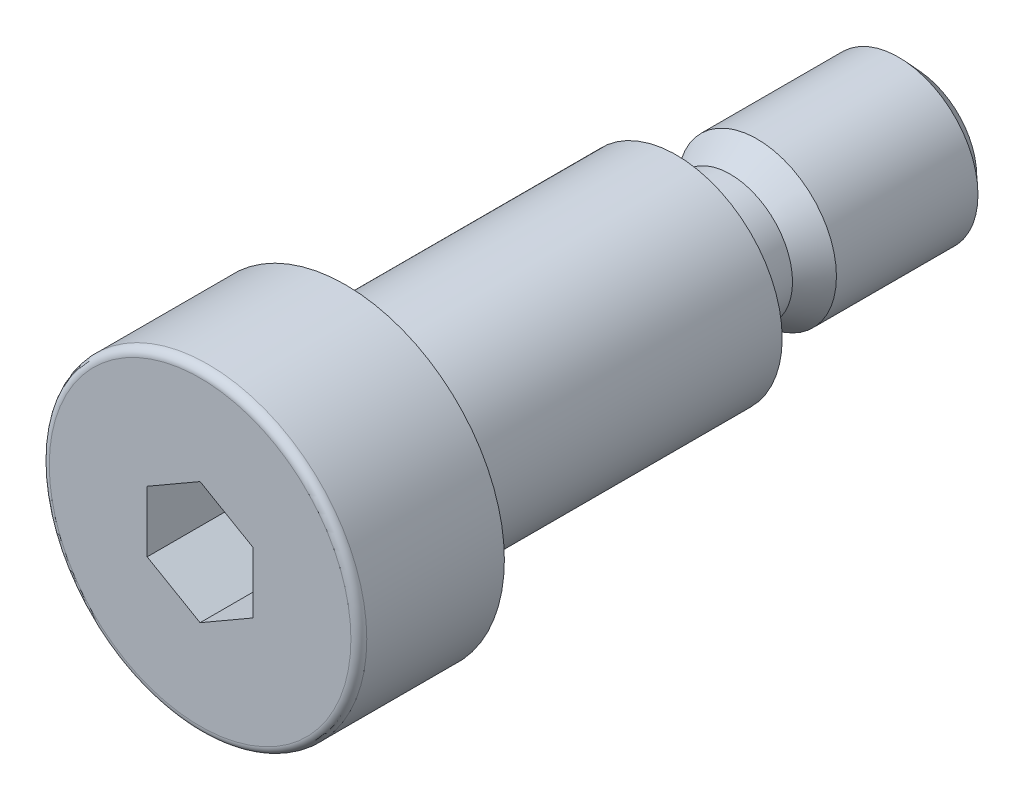
from build123d import *

# Parameters (mm, degrees)
SZKIC1_W                   = 4.7
SZKIC1_H                   = 4.08
WYTNIJ_WYCI_GNI_CIE1_DEPTH = 6.6
ZAOKR_GLENIE1_R            = 0.6


with BuildPart() as part:
    # Szkic1 → Obrót1 (revolve)
    with BuildSketch(Plane(origin=(0, 0, 0), x_dir=(1, 0, 0), z_dir=(0, 1, 0)), mode=Mode.PRIVATE) as obr_t1_sk:
        Polygon((0, -23.5), (0, -12.5), (-8, -12.5), (-12, -12.5), (-12, -23.5), align=None)
        Polygon((0, -12.5), (0, 12.5), (-4.7, 12.5), (-8, 12.5), (-8, -12.5), align=None)
        with Locations((-2.35, 14.54)):
            Rectangle(SZKIC1_W, SZKIC1_H)
        Polygon((-4.7, 16.58), (0, 16.58), (0, 30.5), (-4.7, 30.5), (-6, 29.3), (-6, 18.6), align=None)
    revolve(obr_t1_sk.sketch.rotate(Axis((0, 0, 23.5), (0, 0, -1)), 180), axis=Axis((0, 0, 23.5), (0, 0, -1)))

    # Szkic2 → Wytnij-wyciągnięcie1 (cut)
    with BuildSketch(Plane.XY.offset(23.5)):
        Polygon((4, 2.309401077), (0, 4.618802154), (-4, 2.309401077), (-4, -2.309401077), (0, -4.618802154), (4, -2.309401077), align=None)
    extrude(amount=-WYTNIJ_WYCI_GNI_CIE1_DEPTH, mode=Mode.SUBTRACT)

    # Zaokrąglenie1
    zaokr_glenie1_edges = [part.edges().sort_by_distance(p)[0] for p in [
        (-12, 0, 23.5),
    ]]
    fillet(zaokr_glenie1_edges, radius=ZAOKR_GLENIE1_R)


solid = part.part
